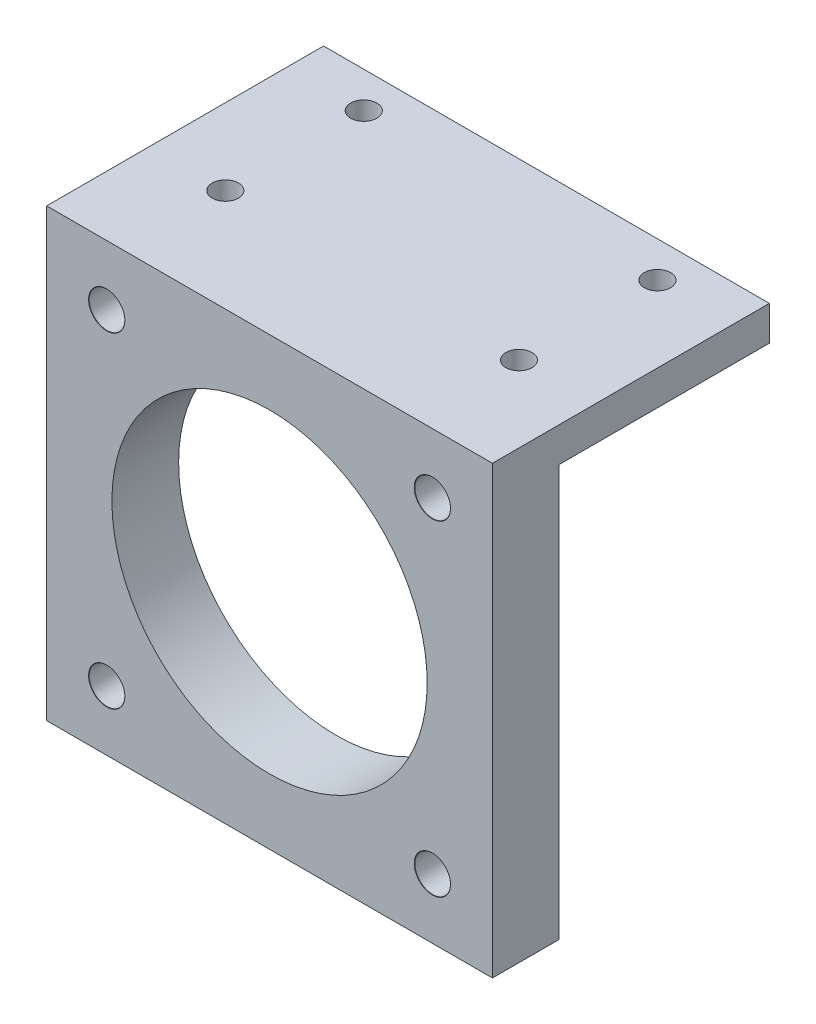
from build123d import *

# Parameters (mm, degrees)
SKETCH1_W                             = 42.418
SKETCH1_H                             = 20
BOSS_EXTRUDE1_DEPTH                   = 6.35
TAP_DRILL_FOR_M3X0_5_TAP2_D           = 2.5
TAP_DRILL_FOR_M3X0_5_TAP2_DEPTH       = 9.248924226
TAP_DRILL_FOR_M3X0_5_TAP2_CSINK_D     = 2.55
TAP_DRILL_FOR_M3X0_5_TAP2_CSINK_ANGLE = 90
TAP_DRILL_FOR_M3X0_5_TAP2_TIP         = 0.751075774
SKETCH12_W                            = 42.418
SKETCH12_H                            = 6.35
BOSS_EXTRUDE2_DEPTH                   = 6.35
SKETCH13_W                            = 42.418
SKETCH13_H                            = 6.35
BOSS_EXTRUDE3_DEPTH                   = 36.068
M3_CLEARANCE_HOLE1_D                  = 3.4
M3_CLEARANCE_HOLE1_CSINK_D            = 3.45
M3_CLEARANCE_HOLE1_CSINK_ANGLE        = 90
SKETCH17_W                            = 42.418
SKETCH17_H                            = 20
CUT_EXTRUDE1_DEPTH                    = 3.068
SKETCH19_R                            = 15
CUT_EXTRUDE2_DEPTH                    = 50.44739432


with BuildPart() as part:
    # Sketch1 → Boss-Extrude1 (new body)
    with BuildSketch(Plane(origin=(0, 0, 0), x_dir=(1, 0, 0), z_dir=(0, 1, 0))):
        Rectangle(SKETCH1_W, SKETCH1_H)
    extrude(amount=BOSS_EXTRUDE1_DEPTH)

    # Tap Drill for M3x0.5 Tap2
    with Locations(Plane(origin=(0, 0, 0), x_dir=(-1, 0, 0), z_dir=(0, -1, 0))):
        with Locations((-13.970620706, 6.587119009), (-13.970620706, -6.587119009), (13.970620706, 6.587119009), (13.970620706, -6.587119009)):
            CounterSinkHole(TAP_DRILL_FOR_M3X0_5_TAP2_D / 2, TAP_DRILL_FOR_M3X0_5_TAP2_CSINK_D / 2, depth=TAP_DRILL_FOR_M3X0_5_TAP2_DEPTH, counter_sink_angle=TAP_DRILL_FOR_M3X0_5_TAP2_CSINK_ANGLE)
            with Locations((0, 0, -(TAP_DRILL_FOR_M3X0_5_TAP2_DEPTH + TAP_DRILL_FOR_M3X0_5_TAP2_TIP / 2))):  # 118° drill point
                Cone(0, TAP_DRILL_FOR_M3X0_5_TAP2_D / 2, TAP_DRILL_FOR_M3X0_5_TAP2_TIP, mode=Mode.SUBTRACT)

    # Sketch12 → Boss-Extrude2 (add)
    with BuildSketch(Plane.XY.offset(10)):
        with Locations((0, 3.175)):
            Rectangle(SKETCH12_W, SKETCH12_H)
    extrude(amount=BOSS_EXTRUDE2_DEPTH)

    # Sketch13 → Boss-Extrude3 (add)
    with BuildSketch(Plane.XZ):
        with Locations((0, 13.175)):
            Rectangle(SKETCH13_W, SKETCH13_H)
    extrude(amount=BOSS_EXTRUDE3_DEPTH)

    # M3 Clearance Hole1 (through all)
    with Locations(Plane.XY.offset(16.35)):
        with Locations((-15.494, 0.635), (15.494, 0.635), (15.494, -30.353), (-15.494, -30.353)):
            CounterSinkHole(M3_CLEARANCE_HOLE1_D / 2, M3_CLEARANCE_HOLE1_CSINK_D / 2, counter_sink_angle=M3_CLEARANCE_HOLE1_CSINK_ANGLE)

    # Sketch17 → Cut-Extrude1 (cut)
    with BuildSketch(Plane.XZ):
        Rectangle(SKETCH17_W, SKETCH17_H)
    extrude(amount=-CUT_EXTRUDE1_DEPTH, mode=Mode.SUBTRACT)

    # Sketch19 → Cut-Extrude2 (cut, through all)
    with BuildSketch(Plane.XY.offset(16.35)):
        with Locations((0, -14.859)):
            Circle(SKETCH19_R)
    extrude(amount=-CUT_EXTRUDE2_DEPTH, mode=Mode.SUBTRACT)


solid = part.part
